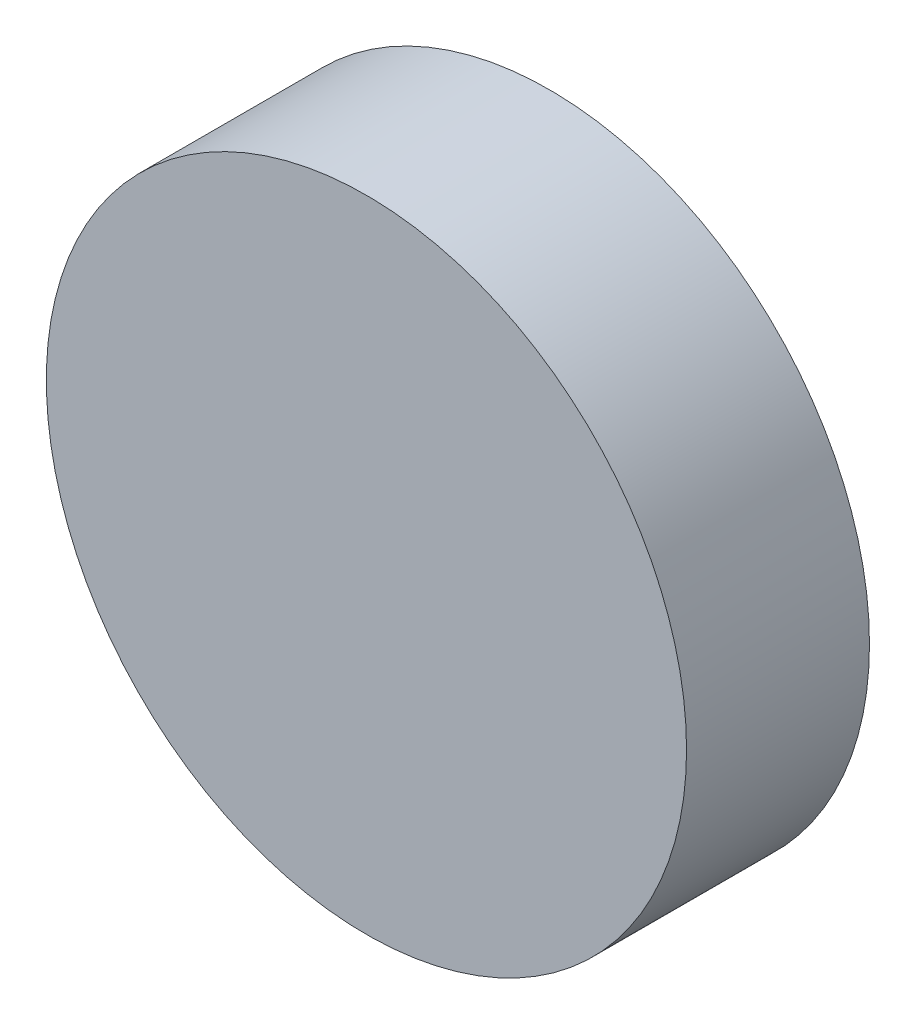
from build123d import *

# Parameters (mm, degrees)
TOPPING_SOG_KONDENSER_FAN_D140_START = -200
SKETCH1_R                            = 70
TOPPING_SOG_KONDENSER_FAN_D140_DEPTH = 40


with BuildPart() as part:
    # Sketch1 → TOPPING_sog_kondenser_fan_D140 (new body)
    with BuildSketch(Plane.XY.offset(TOPPING_SOG_KONDENSER_FAN_D140_START)):
        with Locations((450, 105)):
            Circle(SKETCH1_R)
    extrude(amount=-TOPPING_SOG_KONDENSER_FAN_D140_DEPTH)


solid = part.part
